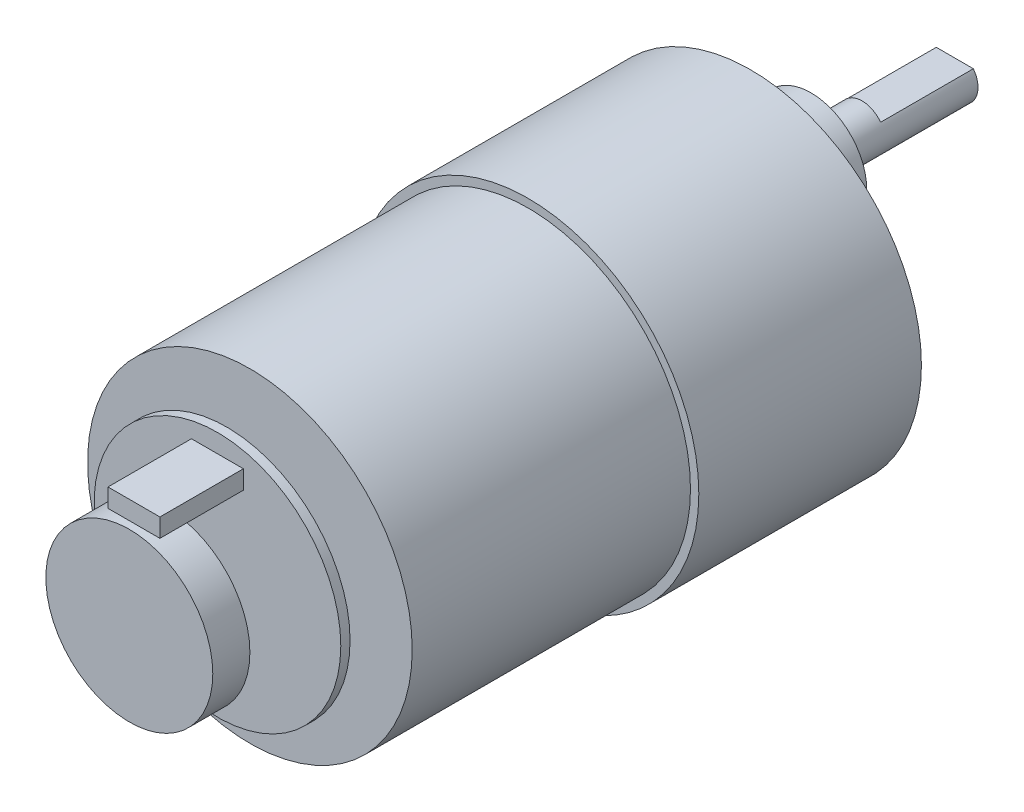
from build123d import *

# Parameters (mm, degrees)
ESBO_O1_R                 = 18.4
RESSALTO_EXTRUS_O1_DEPTH  = 24
ESBO_O2_R                 = 17.5
RESSALTO_EXTRUS_O2_DEPTH  = 30
ESBO_O3_R                 = 6
RESSALTO_EXTRUS_O3_DEPTH  = 6.5
ESBO_O4_R                 = 2.5
RESSALTO_EXTRUS_O4_DEPTH  = 15.5
ESBO_O5_R                 = 1.5
CORTE_EXTRUS_O1_DEPTH     = 10
ESBO_O6_R                 = 1
RESSALTO_EXTRUS_O5_DEPTH  = 2.5
ESBO_O8_R                 = 13.3
RESSALTO_EXTRUS_O7_DEPTH  = 1
ESBO_O9_R                 = 1
RESSALTO_EXTRUS_O8_DEPTH  = 5.5
ESBO_O10_R                = 9
RESSALTO_EXTRUS_O9_DEPTH  = 4
ESBO_O11_W                = 5.6
ESBO_O11_H                = 2
RESSALTO_EXTRUS_O10_DEPTH = 9
ESBO_O12_OUTSIDE_W        = 59.42
ESBO_O12_OUTSIDE_H        = 59.42
CORTE_EXTRUS_O2_DEPTH     = 10


with BuildPart() as part:
    # Esboço1 → Ressalto-extrusão1 (new body)
    with BuildSketch(Plane.XY):
        Circle(ESBO_O1_R)
    extrude(amount=RESSALTO_EXTRUS_O1_DEPTH)

    # Esboço2 → Ressalto-extrusão2 (add)
    with BuildSketch(Plane.XY.offset(24)):
        Circle(ESBO_O2_R)
    extrude(amount=RESSALTO_EXTRUS_O2_DEPTH)

    # Esboço3 → Ressalto-extrusão3 (add)
    with BuildSketch(Plane(origin=(0, 0, 0), x_dir=(-1, 0, 0), z_dir=(0, 0, -1))):
        with Locations(Location((0, 7, 0), (0, 0, 180))):
            Circle(ESBO_O3_R)
    extrude(amount=RESSALTO_EXTRUS_O3_DEPTH)

    # Esboço4 → Ressalto-extrusão4 (add)
    with BuildSketch(Plane(origin=(0, 0, -6.5), x_dir=(-1, 0, 0), z_dir=(0, 0, -1))):
        with Locations((0, 7)):
            Circle(ESBO_O4_R)
    extrude(amount=RESSALTO_EXTRUS_O4_DEPTH)

    # Esboço5 → Corte-extrusão1 (cut)
    with BuildSketch(Plane(origin=(0, 0, 0), x_dir=(-1, 0, 0), z_dir=(0, 0, -1))):
        with Locations((7.485925154, 12.966002708)):
            Circle(ESBO_O5_R)
        with Locations((14.971850307, 0)):
            Circle(ESBO_O5_R)
        with Locations((7.485925154, -12.966002708)):
            Circle(ESBO_O5_R)
        with Locations((-7.485925154, -12.966002708)):
            Circle(ESBO_O5_R)
        with Locations((-14.971850307, 0)):
            Circle(ESBO_O5_R)
        with Locations((-7.485925154, 12.966002708)):
            Circle(ESBO_O5_R)
    extrude(amount=-CORTE_EXTRUS_O1_DEPTH, mode=Mode.SUBTRACT)

    # Esboço6 → Ressalto-extrusão5 (add)
    with BuildSketch(Plane.XY.offset(54)):
        Circle(ESBO_O6_R)
    extrude(amount=RESSALTO_EXTRUS_O5_DEPTH)

    # Esboço8 → Ressalto-extrusão7 (add)
    with BuildSketch(Plane.XY.offset(56.5)):
        Circle(ESBO_O8_R)
    extrude(amount=RESSALTO_EXTRUS_O7_DEPTH)

    # Esboço9 → Ressalto-extrusão8 (add)
    with BuildSketch(Plane.XY.offset(57.5)):
        Circle(ESBO_O9_R)
    extrude(amount=RESSALTO_EXTRUS_O8_DEPTH)

    # Esboço10 → Ressalto-extrusão9 (add)
    with BuildSketch(Plane.XY.offset(63)):
        Circle(ESBO_O10_R)
    extrude(amount=RESSALTO_EXTRUS_O9_DEPTH)

    # Esboço11 → Ressalto-extrusão10 (add)
    with BuildSketch(Plane.XY.offset(57.5)):
        with Locations((0, 10.3)):
            Rectangle(ESBO_O11_W, ESBO_O11_H)
    extrude(amount=RESSALTO_EXTRUS_O10_DEPTH)

    # Esboço12 outside → Corte-extrusão2 (cut)
    with BuildSketch(Plane(origin=(0, 0, -22), x_dir=(-1, 0, 0), z_dir=(0, 0, -1))):
        Rectangle(ESBO_O12_OUTSIDE_W, ESBO_O12_OUTSIDE_H)
        with BuildLine():
            Line((2, 8.5), (-2, 8.5))
            ThreePointArc((-2, 8.5), (0, 4.5), (2, 8.5))
        make_face(mode=Mode.SUBTRACT)
    extrude(amount=-CORTE_EXTRUS_O2_DEPTH, mode=Mode.SUBTRACT)


solid = part.part
